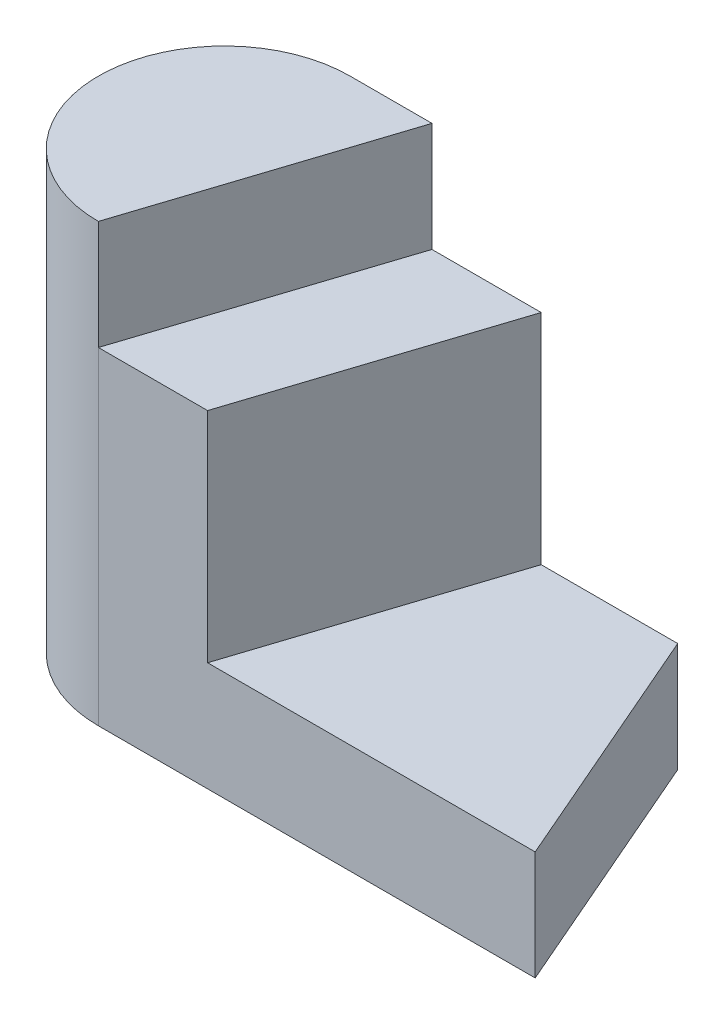
from build123d import *

# Parameters (mm, degrees)
BOSS_EXTRUDE1_DEPTH = 10
BOSS_EXTRUDE2_DEPTH = 20
BOSS_EXTRUDE3_DEPTH = 30


with BuildPart() as part:
    # Sketch1 → Boss-Extrude1 (new body)
    with BuildSketch(Plane(origin=(0, 0, 0), x_dir=(1, 0, 0), z_dir=(0, 1, 0))):
        with BuildLine():
            Line((0, 11.52564913), (30, 11.52564913))
            Line((30, 11.52564913), (40, -11.52564913))
            Line((40, -11.52564913), (0, -11.52564913))
            ThreePointArc((0, -11.52564913), (-11.52564913, 0), (0, 11.52564913))
        make_face()
    extrude(amount=BOSS_EXTRUDE1_DEPTH)

    # Sketch2 → Boss-Extrude2 (add)
    with BuildSketch(Plane(origin=(0, 10, 0), x_dir=(1, 0, 0), z_dir=(0, 1, 0))):
        Polygon((7.498547434, 11.52564913), (17.498547434, 11.52564913), (10, -11.52564913), (0, -11.52564913), align=None)
    extrude(amount=BOSS_EXTRUDE2_DEPTH)

    # Sketch3 → Boss-Extrude3 (add)
    with BuildSketch(Plane(origin=(0, 10, 0), x_dir=(1, 0, 0), z_dir=(0, 1, 0))):
        with BuildLine():
            Line((0, 11.52564913), (7.498547434, 11.52564913))
            Line((7.498547434, 11.52564913), (0, -11.52564913))
            ThreePointArc((0, -11.52564913), (-11.52564913, 0), (0, 11.52564913))
        make_face()
    extrude(amount=BOSS_EXTRUDE3_DEPTH)


solid = part.part
